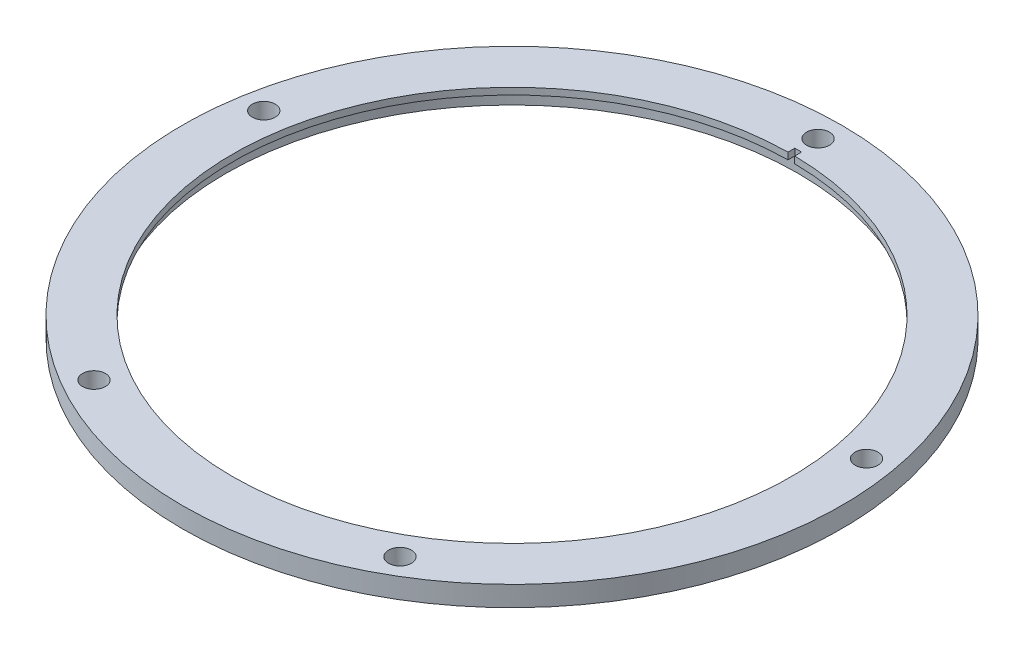
from build123d import *

# Parameters (mm, degrees)
SKETCH1_R           = 49
SKETCH1_R_2         = 41.538
BOSS_EXTRUDE1_DEPTH = 1
CUT_EXTRUDE1_START  = -10
CUT_EXTRUDE1_DEPTH  = 10
CUT_EXTRUDE2_DEPTH  = 10
BOSS_EXTRUDE2_START = 2
SKETCH4_R           = 49
SKETCH4_R_2         = 42.55
BOSS_EXTRUDE2_DEPTH = 2
SKETCH5_R           = 1.7
CUT_EXTRUDE3_DEPTH  = 95.04770922


with BuildPart() as part:
    # Sketch1 → Boss-Extrude1 (new body)
    with BuildSketch(Plane(origin=(0, 0, 0), x_dir=(1, 0, 0), z_dir=(0, 1, 0))):
        with Locations(Location((-17.234280104, -2.988648948, 0), (0, 0, 270))):
            Circle(SKETCH1_R)
        with Locations(Location((-17.234280104, -2.988648948, 0), (0, 0, 270))):
            Circle(SKETCH1_R_2, mode=Mode.SUBTRACT)
    extrude(amount=BOSS_EXTRUDE1_DEPTH)

    # Sketch2 → Cut-Extrude1 (cut)
    with BuildSketch(Plane(origin=(0, 1, 0), x_dir=(1, 0, 0), z_dir=(0, 1, 0)).offset(CUT_EXTRUDE1_START)):
        with BuildLine():
            Line((-16.734280104, 38.54634165), (-16.734280104, 39.546412401))
            ThreePointArc((-16.734280104, 39.546412401), (-17.234280104, 39.549351052), (-17.734280104, 39.546412401))
            Line((-17.734280104, 39.546412401), (-17.734280104, 38.54634165))
            ThreePointArc((-17.734280104, 38.54634165), (-17.234280104, 38.549351052), (-16.734280104, 38.54634165))
        make_face()
    extrude(amount=CUT_EXTRUDE1_DEPTH, mode=Mode.SUBTRACT)

    # Sketch3 → Cut-Extrude2 (cut)
    with BuildSketch(Plane.XZ):
        with BuildLine():
            Line((-17.734280104, -38.54634165), (-17.734280104, -39.55841323))
            ThreePointArc((-17.734280104, -39.55841323), (-17.234280104, -39.561351052), (-16.734280104, -39.55841323))
            Line((-16.734280104, -39.55841323), (-16.734280104, -38.54634165))
            ThreePointArc((-16.734280104, -38.54634165), (-17.234280104, -38.549351052), (-17.734280104, -38.54634165))
        make_face()
    extrude(amount=-CUT_EXTRUDE2_DEPTH, mode=Mode.SUBTRACT)

    # Sketch4 → Boss-Extrude2 (add)
    with BuildSketch(Plane.XZ.offset(BOSS_EXTRUDE2_START)):
        with Locations(Location((-17.234280104, 2.988648948, 0), (0, 0, 270))):
            Circle(SKETCH4_R)
        with Locations(Location((-17.234280104, 2.988648948, 0), (0, 0, 270))):
            Circle(SKETCH4_R_2, mode=Mode.SUBTRACT)
    extrude(amount=-BOSS_EXTRUDE2_DEPTH)

    # Sketch5 → Cut-Extrude3 (cut, through all)
    with BuildSketch(Plane(origin=(12.15729015, 4, 5.600017102), x_dir=(1, 0, 0), z_dir=(0, 1, 0))):
        with Locations(Location((-29.391570254, 48.111368154, 0), (0, 0, 180))):
            Circle(SKETCH5_R)
        with Locations(Location((-74.200323016, 10.512360238, 0), (0, 0, 180))):
            Circle(SKETCH5_R)
        with Locations(Location((-52.141570254, -36.792787718, 0), (0, 0, 180))):
            Circle(SKETCH5_R)
        with Locations(Location((-6.641570254, -36.792787718, 0), (0, 0, 180))):
            Circle(SKETCH5_R)
        with Locations(Location((15.417182508, 10.512360238, 0), (0, 0, 180))):
            Circle(SKETCH5_R)
    extrude(amount=-CUT_EXTRUDE3_DEPTH, mode=Mode.SUBTRACT)


solid = part.part
